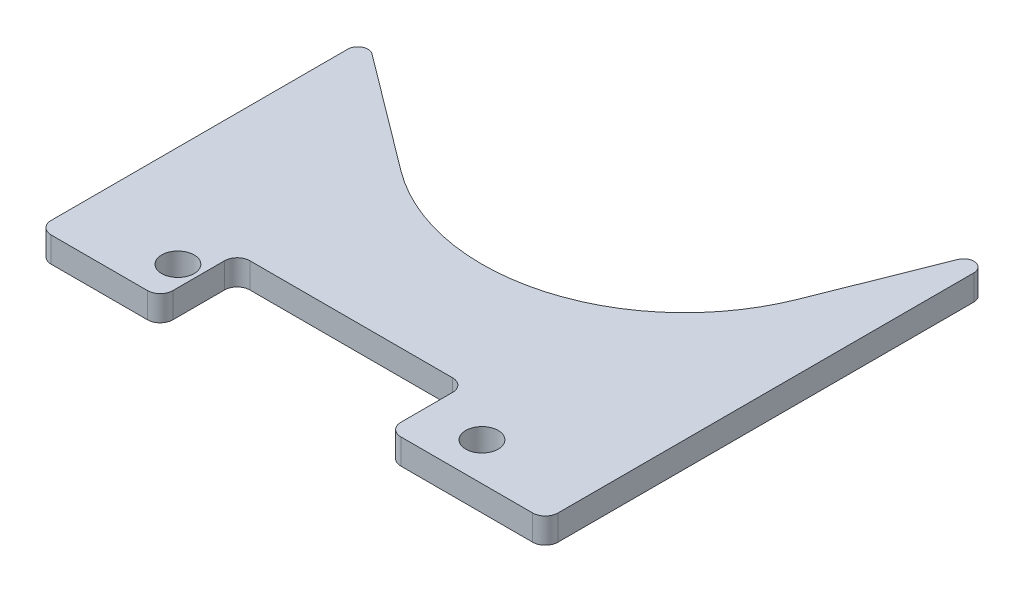
from build123d import *

# Parameters (mm, degrees)
SKETCH1_W           = 63.5
SKETCH1_H           = 60.325
BOSS_EXTRUDE1_DEPTH = 3.175
SKETCH2_R           = 2.032
CUT_EXTRUDE1_DEPTH  = 44.908080478
SKETCH3_W           = 28.575
SKETCH3_H           = 9.652
CUT_EXTRUDE2_DEPTH  = 44.908080478
FILLET1_R           = 1.5875
CUT_EXTRUDE4_DEPTH  = 44.908080478
FILLET2_R           = 1.27


with BuildPart() as part:
    # Sketch1 → Boss-Extrude1 (new body)
    with BuildSketch(Plane(origin=(0, 0, 0), x_dir=(1, 0, 0), z_dir=(0, 1, 0))):
        Rectangle(SKETCH1_W, SKETCH1_H)
    extrude(amount=BOSS_EXTRUDE1_DEPTH)

    # Sketch2 → Cut-Extrude1 (cut, through all)
    with BuildSketch(Plane(origin=(0, 0, 0), x_dir=(-1, 0, 0), z_dir=(0, -1, 0))):
        with Locations(Location((-19.05, -25.4, 0), (0, 0, 90))):
            Circle(SKETCH2_R)
        with Locations(Location((19.05, -25.4, 0), (0, 0, 90))):
            Circle(SKETCH2_R)
    extrude(amount=-CUT_EXTRUDE1_DEPTH, mode=Mode.SUBTRACT)

    # Sketch3 → Cut-Extrude2 (cut, through all)
    with BuildSketch(Plane(origin=(0, 3.175, 0), x_dir=(1, 0, 0), z_dir=(0, 1, 0))):
        with Locations((-2.2225, -25.3365)):
            Rectangle(SKETCH3_W, SKETCH3_H)
    extrude(amount=-CUT_EXTRUDE2_DEPTH, mode=Mode.SUBTRACT)

    # Fillet1
    fillet1_edges = [part.edges().sort_by_distance(p)[0] for p in [
        (-16.51, 1.5875, 30.1625),
        (-16.51, 1.5875, 20.5105),
        (12.065, 1.5875, 20.5105),
        (12.065, 1.5875, 30.1625),
        (31.75, 1.5875, 30.1625),
        (-31.75, 1.5875, 30.1625),
    ]]
    fillet(fillet1_edges, radius=FILLET1_R)

    # Sketch5 → Cut-Extrude4 (cut, through all)
    with BuildSketch(Plane(origin=(0, 3.175, 0), x_dir=(1, 0, 0), z_dir=(0, 1, 0))):
        with BuildLine():
            Line((-15.24, -1.27), (-31.75, 11.1125))
            Line((-31.75, 11.1125), (-31.75, 30.1625))
            Line((-31.75, 30.1625), (31.75, 30.1625))
            Line((31.75, 30.1625), (23.603733945, 9.667903014))
            ThreePointArc((23.603733945, 9.667903014), (6.884580014, -5.399183177), (-15.24, -1.27))
        make_face()
    extrude(amount=-CUT_EXTRUDE4_DEPTH, mode=Mode.SUBTRACT)

    # Fillet2
    fillet2_edges = [part.edges().sort_by_distance(p)[0] for p in [
        (31.75, 1.5875, -30.1625),
        (-31.75, 1.5875, -11.1125),
    ]]
    fillet(fillet2_edges, radius=FILLET2_R)


solid = part.part
